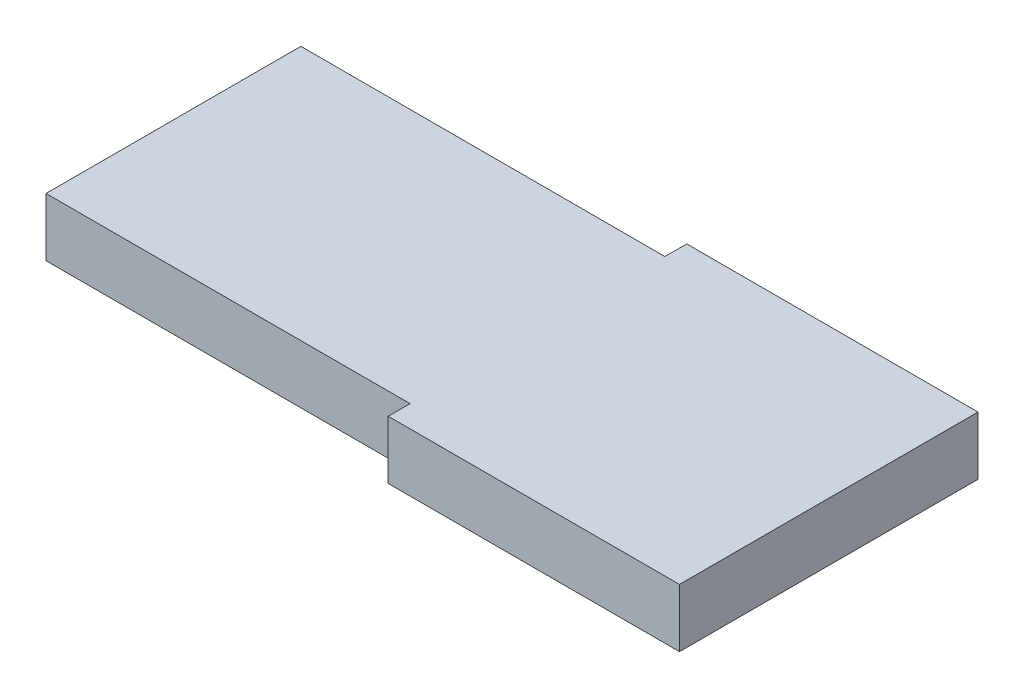
from build123d import *

# Parameters (mm, degrees)
BOSS_EXTRUDE1_DEPTH = 8


with BuildPart() as part:
    # Sketch1 → Boss-Extrude1 (new body)
    with BuildSketch(Plane(origin=(0, 0, 0), x_dir=(1, 0, 0), z_dir=(0, 1, 0))):
        Polygon((25, 20.5), (25, 17.5), (-25, 17.5), (-25, -17.5), (25, -17.5), (25, -20.5), (65, -20.5), (65, 20.5), align=None)
    extrude(amount=BOSS_EXTRUDE1_DEPTH)


solid = part.part
